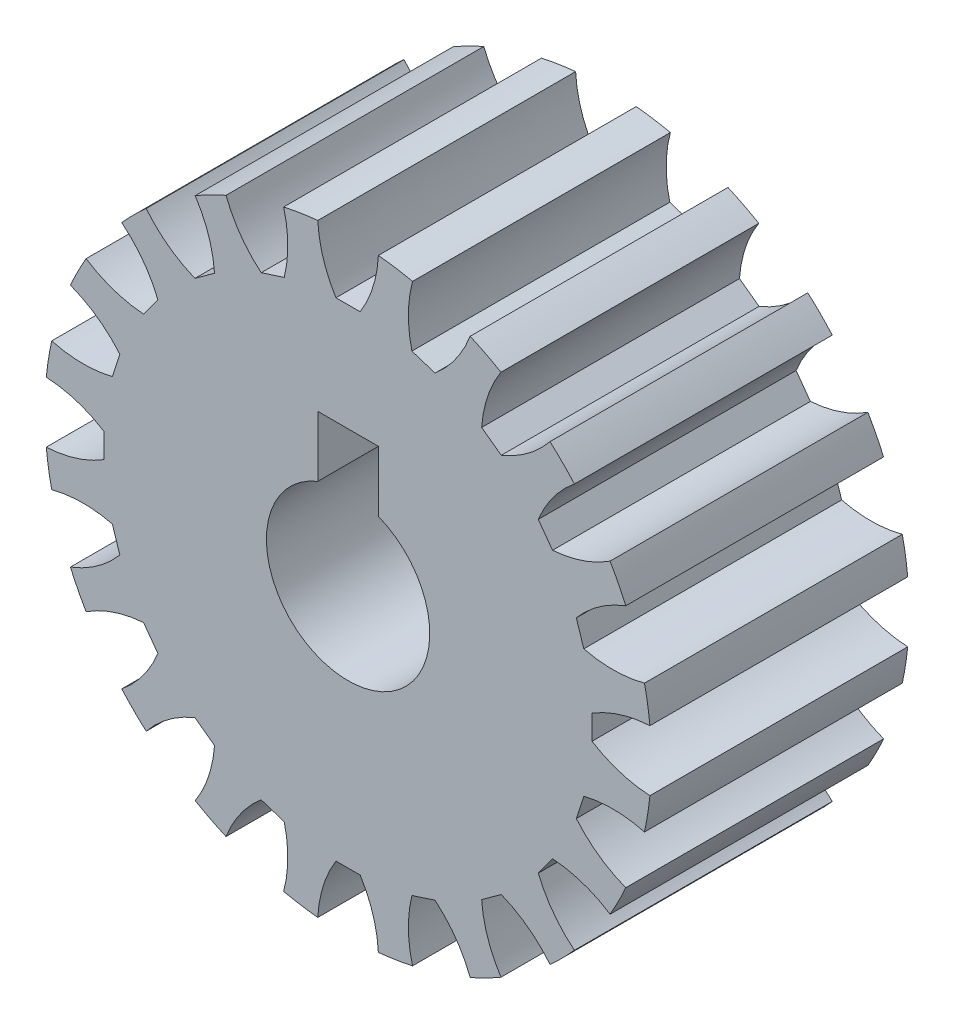
from build123d import *

# Parameters (mm, degrees)
SKETCH1_R           = 100
BOSS_EXTRUDE1_DEPTH = 85
CUT_EXTRUDE2_DEPTH  = 85
CUT_EXTRUDE17_DEPTH = 144


with BuildPart() as part:
    # Sketch1 → Boss-Extrude1 (new body)
    with BuildSketch(Plane.XY):
        Circle(SKETCH1_R)
    extrude(amount=BOSS_EXTRUDE1_DEPTH)

    # Sketch2 → Cut-Extrude2 (cut)
    with BuildSketch(Plane.XY.offset(85)):
        with BuildLine():
            Line((0, 45), (-10, 45))
            Line((-10, 45), (-10, 25))
            ThreePointArc((-10, 25), (0, -26.925824036), (10, 25))
            Line((10, 25), (10, 45))
            Line((10, 45), (0, 45))
        make_face()
    extrude(amount=-CUT_EXTRUDE2_DEPTH, mode=Mode.SUBTRACT)

    # Sketch3 → Cut-Extrude17 (cut)
    with BuildSketch(Plane.XY):
        with BuildLine():
            Line((4, 80.412826854), (-4, 80.412826854))
            ThreePointArc((-4, 80.412826854), (-8.212095444, 89.574227067), (-9.987492178, 99.5))
            ThreePointArc((-9.987492178, 99.5), (0, 110), (9.987492178, 99.5))
            ThreePointArc((9.987492178, 99.5), (8.212095444, 89.574227067), (4, 80.412826854))
        make_face()
        with BuildLine():
            Line((28.653156129, 75.241074996), (21.044703998, 77.713210951))
            ThreePointArc((21.044703998, 77.713210951), (19.869791537, 87.727829396), (21.248521423, 97.716428185))
            ThreePointArc((21.248521423, 97.716428185), (33.991869381, 104.616216792), (40.245860457, 91.543818557))
            ThreePointArc((40.245860457, 91.543818557), (35.490125306, 82.652475292), (28.653156129, 75.241074996))
        make_face()
        with BuildLine():
            Line((50.501541697, 62.704202481), (44.029405742, 67.4064845))
            ThreePointArc((44.029405742, 67.4064845), (46.006684882, 77.294020547), (50.4045817, 86.36769155))
            ThreePointArc((50.4045817, 86.36769155), (64.656377752, 88.991869381), (66.564683506, 74.626690331))
            ThreePointArc((66.564683506, 74.626690331), (59.294134429, 67.640123362), (50.501541697, 62.704202481))
        make_face()
        with BuildLine():
            Line((67.4064845, 44.029405742), (62.704202481, 50.501541697))
            ThreePointArc((62.704202481, 50.501541697), (67.640123362, 59.294134429), (74.626690331, 66.564683506))
            ThreePointArc((74.626690331, 66.564683506), (88.991869381, 64.656377752), (86.36769155, 50.4045817))
            ThreePointArc((86.36769155, 50.4045817), (77.294020547, 46.006684882), (67.4064845, 44.029405742))
        make_face()
        with BuildLine():
            Line((77.713210951, 21.044703998), (75.241074996, 28.653156129))
            ThreePointArc((75.241074996, 28.653156129), (82.652475292, 35.490125306), (91.543818557, 40.245860457))
            ThreePointArc((91.543818557, 40.245860457), (104.616216792, 33.991869381), (97.716428185, 21.248521423))
            ThreePointArc((97.716428185, 21.248521423), (87.727829396, 19.869791537), (77.713210951, 21.044703998))
        make_face()
        with BuildLine():
            Line((80.412826854, -4), (80.412826854, 4))
            ThreePointArc((80.412826854, 4), (89.574227067, 8.212095444), (99.5, 9.987492178))
            ThreePointArc((99.5, 9.987492178), (110, 0), (99.5, -9.987492178))
            ThreePointArc((99.5, -9.987492178), (89.574227067, -8.212095444), (80.412826854, -4))
        make_face()
        with BuildLine():
            Line((75.241074996, -28.653156129), (77.713210951, -21.044703998))
            ThreePointArc((77.713210951, -21.044703998), (87.727829396, -19.869791537), (97.716428185, -21.248521423))
            ThreePointArc((97.716428185, -21.248521423), (104.616216792, -33.991869381), (91.543818557, -40.245860457))
            ThreePointArc((91.543818557, -40.245860457), (82.652475292, -35.490125306), (75.241074996, -28.653156129))
        make_face()
        with BuildLine():
            Line((62.704202481, -50.501541697), (67.4064845, -44.029405742))
            ThreePointArc((67.4064845, -44.029405742), (77.294020547, -46.006684882), (86.36769155, -50.4045817))
            ThreePointArc((86.36769155, -50.4045817), (88.991869381, -64.656377752), (74.626690331, -66.564683506))
            ThreePointArc((74.626690331, -66.564683506), (67.640123362, -59.294134429), (62.704202481, -50.501541697))
        make_face()
        with BuildLine():
            Line((44.029405742, -67.4064845), (50.501541697, -62.704202481))
            ThreePointArc((50.501541697, -62.704202481), (59.294134429, -67.640123362), (66.564683506, -74.626690331))
            ThreePointArc((66.564683506, -74.626690331), (64.656377752, -88.991869381), (50.4045817, -86.36769155))
            ThreePointArc((50.4045817, -86.36769155), (46.006684882, -77.294020547), (44.029405742, -67.4064845))
        make_face()
        with BuildLine():
            Line((21.044703998, -77.713210951), (28.653156129, -75.241074996))
            ThreePointArc((28.653156129, -75.241074996), (35.490125306, -82.652475292), (40.245860457, -91.543818557))
            ThreePointArc((40.245860457, -91.543818557), (33.991869381, -104.616216792), (21.248521423, -97.716428185))
            ThreePointArc((21.248521423, -97.716428185), (19.869791537, -87.727829396), (21.044703998, -77.713210951))
        make_face()
        with BuildLine():
            Line((-4, -80.412826854), (4, -80.412826854))
            ThreePointArc((4, -80.412826854), (8.212095444, -89.574227067), (9.987492178, -99.5))
            ThreePointArc((9.987492178, -99.5), (0, -110), (-9.987492178, -99.5))
            ThreePointArc((-9.987492178, -99.5), (-8.212095444, -89.574227067), (-4, -80.412826854))
        make_face()
        with BuildLine():
            Line((-28.653156129, -75.241074996), (-21.044703998, -77.713210951))
            ThreePointArc((-21.044703998, -77.713210951), (-19.869791537, -87.727829396), (-21.248521423, -97.716428185))
            ThreePointArc((-21.248521423, -97.716428185), (-33.991869381, -104.616216792), (-40.245860457, -91.543818557))
            ThreePointArc((-40.245860457, -91.543818557), (-35.490125306, -82.652475292), (-28.653156129, -75.241074996))
        make_face()
        with BuildLine():
            Line((-50.501541697, -62.704202481), (-44.029405742, -67.4064845))
            ThreePointArc((-44.029405742, -67.4064845), (-46.006684882, -77.294020547), (-50.4045817, -86.36769155))
            ThreePointArc((-50.4045817, -86.36769155), (-64.656377752, -88.991869381), (-66.564683506, -74.626690331))
            ThreePointArc((-66.564683506, -74.626690331), (-59.294134429, -67.640123362), (-50.501541697, -62.704202481))
        make_face()
        with BuildLine():
            Line((-67.4064845, -44.029405742), (-62.704202481, -50.501541697))
            ThreePointArc((-62.704202481, -50.501541697), (-67.640123362, -59.294134429), (-74.626690331, -66.564683506))
            ThreePointArc((-74.626690331, -66.564683506), (-88.991869381, -64.656377752), (-86.36769155, -50.4045817))
            ThreePointArc((-86.36769155, -50.4045817), (-77.294020547, -46.006684882), (-67.4064845, -44.029405742))
        make_face()
        with BuildLine():
            Line((-77.713210951, -21.044703998), (-75.241074996, -28.653156129))
            ThreePointArc((-75.241074996, -28.653156129), (-82.652475292, -35.490125306), (-91.543818557, -40.245860457))
            ThreePointArc((-91.543818557, -40.245860457), (-104.616216792, -33.991869381), (-97.716428185, -21.248521423))
            ThreePointArc((-97.716428185, -21.248521423), (-87.727829396, -19.869791537), (-77.713210951, -21.044703998))
        make_face()
        with BuildLine():
            Line((-80.412826854, 4), (-80.412826854, -4))
            ThreePointArc((-80.412826854, -4), (-89.574227067, -8.212095444), (-99.5, -9.987492178))
            ThreePointArc((-99.5, -9.987492178), (-110, 0), (-99.5, 9.987492178))
            ThreePointArc((-99.5, 9.987492178), (-89.574227067, 8.212095444), (-80.412826854, 4))
        make_face()
        with BuildLine():
            Line((-75.241074996, 28.653156129), (-77.713210951, 21.044703998))
            ThreePointArc((-77.713210951, 21.044703998), (-87.727829396, 19.869791537), (-97.716428185, 21.248521423))
            ThreePointArc((-97.716428185, 21.248521423), (-104.616216792, 33.991869381), (-91.543818557, 40.245860457))
            ThreePointArc((-91.543818557, 40.245860457), (-82.652475292, 35.490125306), (-75.241074996, 28.653156129))
        make_face()
        with BuildLine():
            Line((-62.704202481, 50.501541697), (-67.4064845, 44.029405742))
            ThreePointArc((-67.4064845, 44.029405742), (-77.294020547, 46.006684882), (-86.36769155, 50.4045817))
            ThreePointArc((-86.36769155, 50.4045817), (-88.991869381, 64.656377752), (-74.626690331, 66.564683506))
            ThreePointArc((-74.626690331, 66.564683506), (-67.640123362, 59.294134429), (-62.704202481, 50.501541697))
        make_face()
        with BuildLine():
            Line((-44.029405742, 67.4064845), (-50.501541697, 62.704202481))
            ThreePointArc((-50.501541697, 62.704202481), (-59.294134429, 67.640123362), (-66.564683506, 74.626690331))
            ThreePointArc((-66.564683506, 74.626690331), (-64.656377752, 88.991869381), (-50.4045817, 86.36769155))
            ThreePointArc((-50.4045817, 86.36769155), (-46.006684882, 77.294020547), (-44.029405742, 67.4064845))
        make_face()
        with BuildLine():
            Line((-21.044703998, 77.713210951), (-28.653156129, 75.241074996))
            ThreePointArc((-28.653156129, 75.241074996), (-35.490125306, 82.652475292), (-40.245860457, 91.543818557))
            ThreePointArc((-40.245860457, 91.543818557), (-33.991869381, 104.616216792), (-21.248521423, 97.716428185))
            ThreePointArc((-21.248521423, 97.716428185), (-19.869791537, 87.727829396), (-21.044703998, 77.713210951))
        make_face()
    extrude(amount=CUT_EXTRUDE17_DEPTH, mode=Mode.SUBTRACT)


solid = part.part
